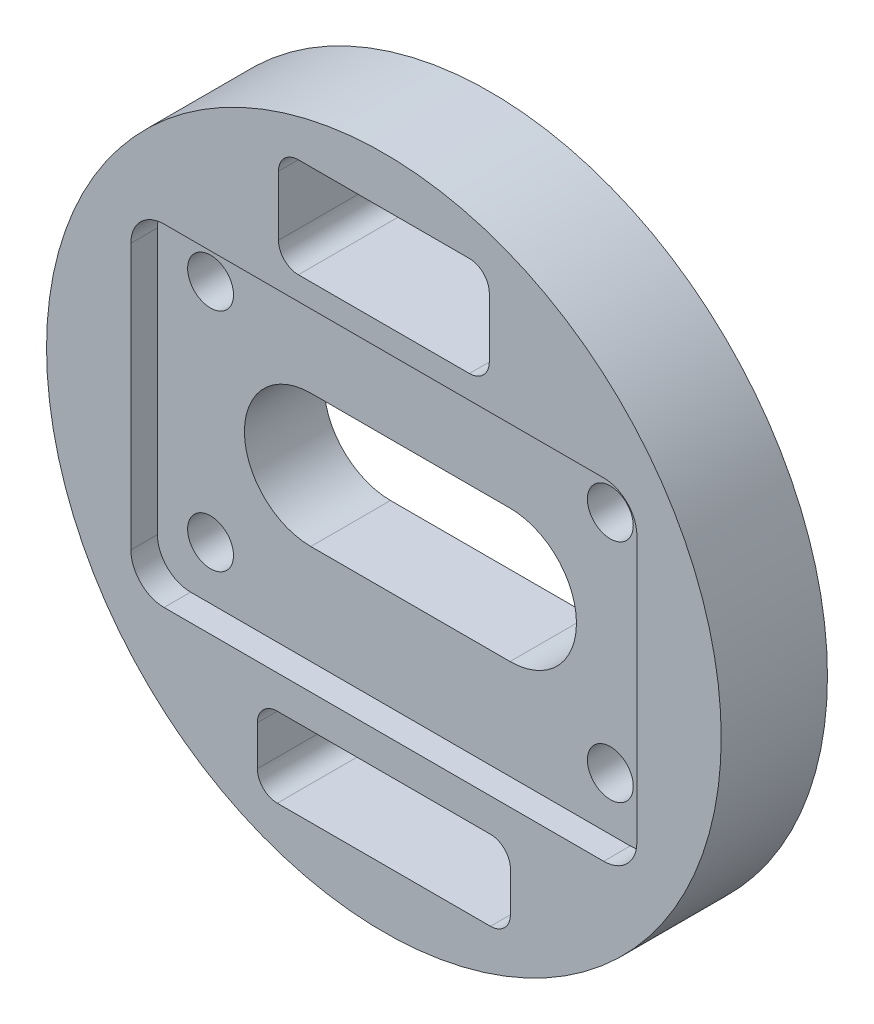
from build123d import *

# Parameters (mm, degrees)
SKETCH1_R             = 25.4
BOSS_EXTRUDE1_DEPTH   = 8
CUT_EXTRUDE1_DEPTH    = 2
CUT_EXTRUDE2_DEPTH    = 37.418676527
F_8_32_TAPPED_HOLE1_D = 3.4544
CUT_EXTRUDE3_DEPTH    = 37.80108694
SKETCH7_W             = 19.05
SKETCH7_H             = 6
CUT_EXTRUDE4_DEPTH    = 37.80108694
FILLET1_R             = 1.5


with BuildPart() as part:
    # Sketch1 → Boss-Extrude1 (new body)
    with BuildSketch(Plane.XY):
        Circle(SKETCH1_R)
    extrude(amount=-BOSS_EXTRUDE1_DEPTH)

    # Sketch2 → Cut-Extrude1 (cut)
    with BuildSketch(Plane.XY):
        with BuildLine():
            Line((-16.55, 12.5), (16.55, 12.5))
            ThreePointArc((16.55, 12.5), (18.317766953, 11.767766953), (19.05, 10))
            Line((19.05, 10), (19.05, -10))
            ThreePointArc((19.05, -10), (18.317766953, -11.767766953), (16.55, -12.5))
            Line((16.55, -12.5), (-16.55, -12.5))
            ThreePointArc((-16.55, -12.5), (-18.317766953, -11.767766953), (-19.05, -10))
            Line((-19.05, -10), (-19.05, 10))
            ThreePointArc((-19.05, 10), (-18.317766953, 11.767766953), (-16.55, 12.5))
        make_face()
    extrude(amount=-CUT_EXTRUDE1_DEPTH, mode=Mode.SUBTRACT)

    # Sketch3 → Cut-Extrude2 (cut, through all)
    with BuildSketch(Plane.XY.offset(-2)):
        with BuildLine():
            Line((-7.5, 5), (7.5, 5))
            ThreePointArc((7.5, 5), (12.5, 0), (7.5, -5))
            Line((7.5, -5), (-7.5, -5))
            ThreePointArc((-7.5, -5), (-12.5, 0), (-7.5, 5))
        make_face()
    extrude(amount=-CUT_EXTRUDE2_DEPTH, mode=Mode.SUBTRACT)

    # #8-32 Tapped Hole1 (through all)
    with Locations(Plane.XY.offset(-2)):
        with Locations((15.05, 8.5), (-15.05, 8.5), (-15.05, -8.5), (15.05, -8.5)):
            Hole(F_8_32_TAPPED_HOLE1_D / 2)

    # Sketch6 → Cut-Extrude3 (cut, through all)
    with BuildSketch(Plane.XY):
        with BuildLine():
            Line((6.4375, 21.75), (-6.4375, 21.75))
            ThreePointArc((-6.4375, 21.75), (-7.498160172, 21.310660172), (-7.9375, 20.25))
            Line((-7.9375, 20.25), (-7.9375, 15.75))
            ThreePointArc((-7.9375, 15.75), (-7.498160172, 14.689339828), (-6.4375, 14.25))
            Line((-6.4375, 14.25), (6.4375, 14.25))
            ThreePointArc((6.4375, 14.25), (7.498160172, 14.689339828), (7.9375, 15.75))
            Line((7.9375, 15.75), (7.9375, 20.25))
            ThreePointArc((7.9375, 20.25), (7.498160172, 21.310660172), (6.4375, 21.75))
        make_face()
    extrude(amount=-CUT_EXTRUDE3_DEPTH, mode=Mode.SUBTRACT)

    # Sketch7 → Cut-Extrude4 (cut, through all)
    with BuildSketch(Plane.XY):
        with Locations((0, -18)):
            Rectangle(SKETCH7_W, SKETCH7_H)
    extrude(amount=-CUT_EXTRUDE4_DEPTH, mode=Mode.SUBTRACT)

    # Fillet1
    fillet1_edges = [part.edges().sort_by_distance(p)[0] for p in [
        (9.525, -15, -4),
        (9.525, -21, -4),
        (-9.525, -21, -4),
        (-9.525, -15, -4),
    ]]
    fillet(fillet1_edges, radius=FILLET1_R)


solid = part.part
